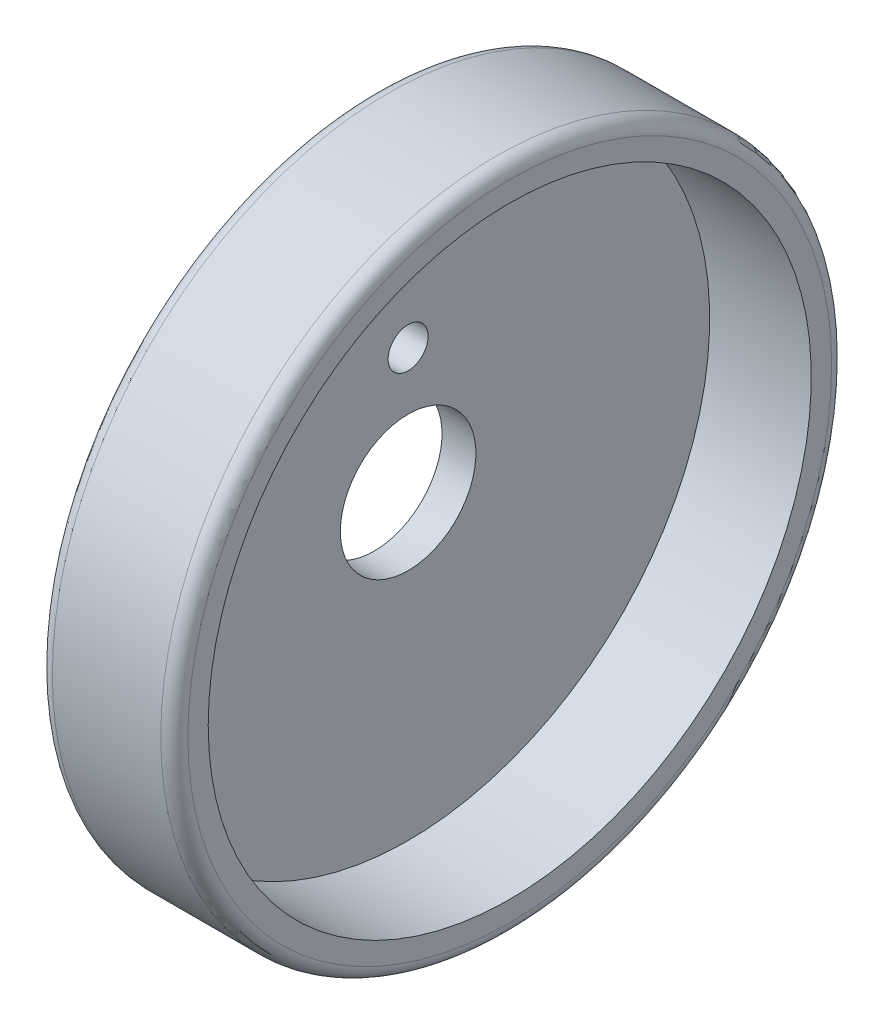
from build123d import *

# Parameters (mm, degrees)
FILLET2_R          = 2
FILLET3_R          = 2
SKETCH2_R          = 2.95
CUT_EXTRUDE1_DEPTH = 13


with BuildPart() as part:
    # Sketch1 → Revolve1 (revolve)
    with BuildSketch(Plane.XY, mode=Mode.PRIVATE) as revolve1_sk:
        Polygon((-12.309472934, 14.722222222), (-27.309472934, 14.722222222), (-27.309472934, -19.777777778), (-32.309472934, -19.777777778), (-32.309472934, 19.722222222), (-12.309472934, 19.722222222), align=None)
    revolve(revolve1_sk.sketch.rotate(Axis((-53.278814679, -29.777777778, 0), (1, 0, 0)), 90), axis=Axis((-53.278814679, -29.777777778, 0), (1, 0, 0)))

    # Fillet2
    fillet2_edges = [part.edges().sort_by_distance(p)[0] for p in [
        (-32.309472934, -29.777777778, -49.5),
    ]]
    fillet(fillet2_edges, radius=FILLET2_R)

    # Fillet3
    fillet3_edges = [part.edges().sort_by_distance(p)[0] for p in [
        (-12.309472934, -29.777777778, -49.5),
    ]]
    fillet(fillet3_edges, radius=FILLET3_R)

    # Sketch2 → Cut-Extrude1 (cut, symmetric)
    with BuildSketch(Plane(origin=(-27.309472934, 0, 0), x_dir=(0, 0, -1), z_dir=(1, 0, 0))):
        with Locations((0, -11.277777778)):
            Circle(SKETCH2_R)
    extrude(amount=CUT_EXTRUDE1_DEPTH, both=True, mode=Mode.SUBTRACT)


solid = part.part
